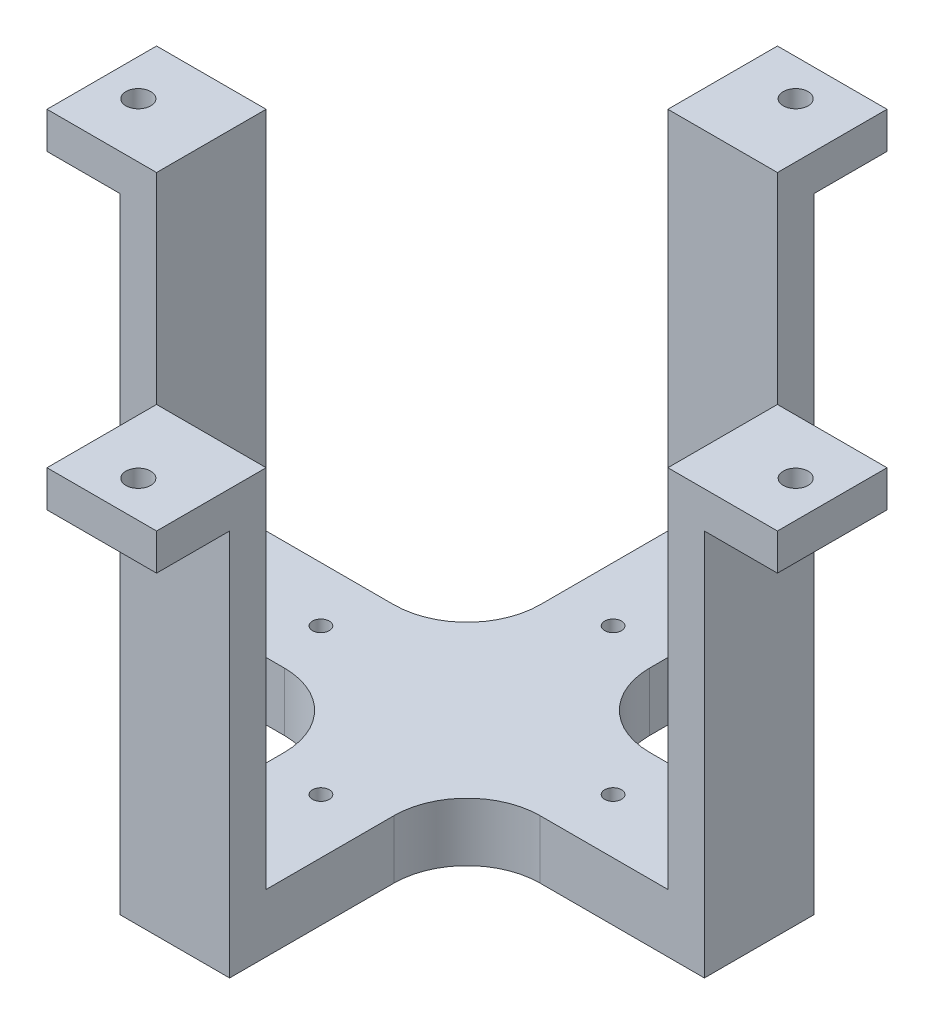
from build123d import *

# Parameters (mm, degrees)
SKETCH2_W           = 15
SKETCH2_H           = 40
BOSS_EXTRUDE1_DEPTH = 8
SKETCH3_W           = 15
SKETCH3_H           = 5
BOSS_EXTRUDE4_DEPTH = 50
SKETCH6_W           = 15
SKETCH6_H           = 10
BOSS_EXTRUDE5_DEPTH = 5
SKETCH8_R           = 1.7
CUT_EXTRUDE1_DEPTH  = 74.247866863
CIRPATTERN1_COUNT   = 4
FILLET1_R           = 10
SKETCH9_R           = 1.15
CUT_EXTRUDE2_DEPTH  = 92.454906921


with BuildPart() as part:
    # Sketch2 → Boss-Extrude1 (new body)
    with BuildSketch(Plane(origin=(0, 0, 0), x_dir=(1, 0, 0), z_dir=(0, 1, 0))):
        with Locations((0, 20)):
            Rectangle(SKETCH2_W, SKETCH2_H)
    boss_extrude1 = extrude(amount=-BOSS_EXTRUDE1_DEPTH)

    # Sketch3 → Boss-Extrude4 (add)
    with BuildSketch(Plane(origin=(0, 0, 0), x_dir=(1, 0, 0), z_dir=(0, 1, 0))):
        with Locations((0, 37.5)):
            Rectangle(SKETCH3_W, SKETCH3_H)
    boss_extrude4 = extrude(amount=BOSS_EXTRUDE4_DEPTH)

    # Sketch6 → Boss-Extrude5 (add)
    with BuildSketch(Plane(origin=(0, 50, 0), x_dir=(1, 0, 0), z_dir=(0, 1, 0))):
        with Locations((0, 45)):
            Rectangle(SKETCH6_W, SKETCH6_H)
    boss_extrude5 = extrude(amount=-BOSS_EXTRUDE5_DEPTH)

    # Sketch8 → Cut-Extrude1 (cut, through all)
    with BuildSketch(Plane.XZ.offset(-45)):
        with Locations(Location((0, -45, 0), (0, 0, 270))):
            Circle(SKETCH8_R)
    cut_extrude1 = extrude(amount=-CUT_EXTRUDE1_DEPTH, mode=Mode.SUBTRACT)

    # CirPattern1: Boss-Extrude1, Boss-Extrude4, Boss-Extrude5, Cut-Extrude1 ×4 about axis
    cirpattern1_axis = Axis((0, 0, 0), (0, 1, 0))
    add([boss_extrude1.rotate(cirpattern1_axis, i * 360 / CIRPATTERN1_COUNT) for i in range(1, CIRPATTERN1_COUNT)])
    add([boss_extrude4.rotate(cirpattern1_axis, i * 360 / CIRPATTERN1_COUNT) for i in range(1, CIRPATTERN1_COUNT)])
    add([boss_extrude5.rotate(cirpattern1_axis, i * 360 / CIRPATTERN1_COUNT) for i in range(1, CIRPATTERN1_COUNT)])
    add([cut_extrude1.rotate(cirpattern1_axis, i * 360 / CIRPATTERN1_COUNT) for i in range(1, CIRPATTERN1_COUNT)], mode=Mode.SUBTRACT)

    # Fillet1
    fillet1_edges = [part.edges().sort_by_distance(p)[0] for p in [
        (-7.5, -4, -7.5),
        (7.5, -4, -7.5),
        (-7.5, -4, 7.5),
        (7.5, -4, 7.5),
    ]]
    fillet(fillet1_edges, radius=FILLET1_R)

    # Sketch9 → Cut-Extrude2 (cut, through all)
    with BuildSketch(Plane.XZ.offset(8)):
        with Locations(Location((0, 20, 0), (0, 0, 270))):
            Circle(SKETCH9_R)
        with Locations(Location((20, 0, 0), (0, 0, 270))):
            Circle(SKETCH9_R)
        with Locations(Location((0, -20, 0), (0, 0, 270))):
            Circle(SKETCH9_R)
        with Locations(Location((-20, 0, 0), (0, 0, 270))):
            Circle(SKETCH9_R)
    extrude(amount=-CUT_EXTRUDE2_DEPTH, mode=Mode.SUBTRACT)


solid = part.part
